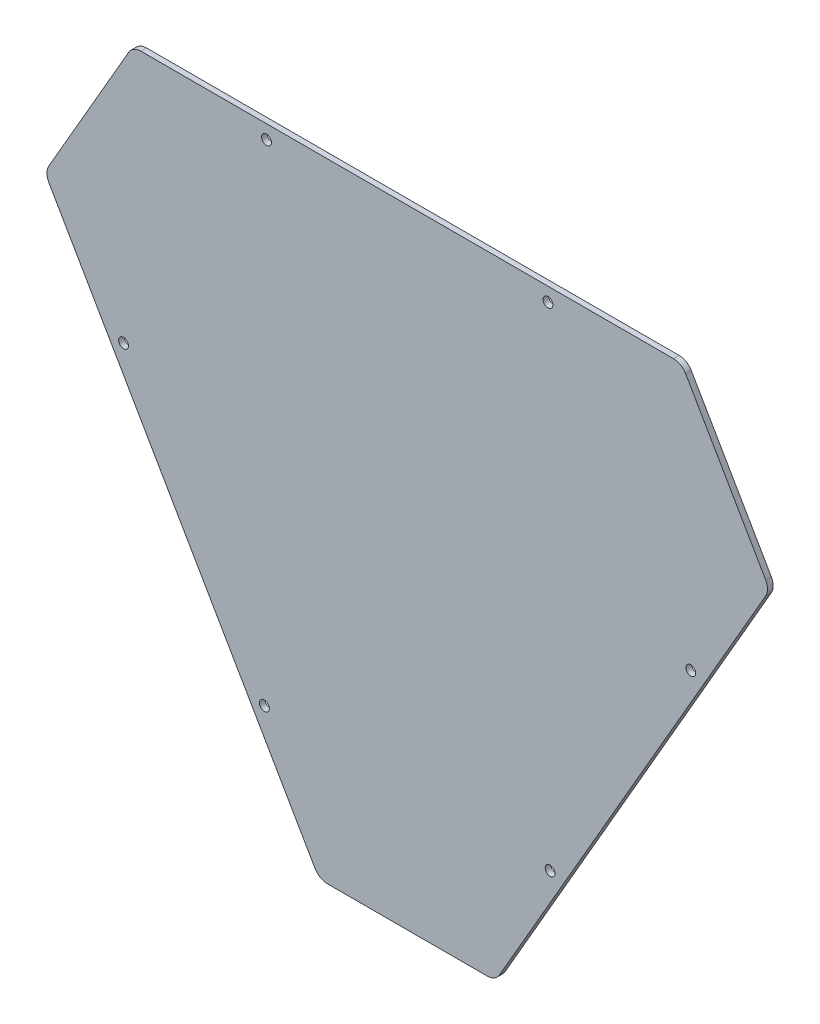
from build123d import *

# Parameters (mm, degrees)
ESTRUSIONE_ESTRUSIONE1_DEPTH = 4
RACCORDO1_R                  = 10
SCHIZZO2_R                   = 3.5
TAGLIO_ESTRUSIONE1_DEPTH     = 10


with BuildPart() as part:
    # Schizzo1 → Estrusione-Estrusione1 (new body)
    with BuildSketch(Plane(origin=(0, 0, 0), x_dir=(-1, 0, 0), z_dir=(0, 0, 1))):
        Polygon((559.259871964, -2.574697247), (461.759871964, 166.300256491), (364.223704599, 335.112566514), (239.016445177, 335.112566514), (44.088779908, -2.637340962), (106.656242253, -111.007364644), (496.656242253, -111.007364644), align=None)
    extrude(amount=ESTRUSIONE_ESTRUSIONE1_DEPTH)

    # Raccordo1
    raccordo1_edges = [part.edges().sort_by_distance(p)[0] for p in [
        (-559.259871964, 2.574697247, 2),
        (-496.656242253, 111.007364644, 2),
        (-106.656242253, 111.007364644, 2),
        (-44.088779908, 2.637340962, 2),
        (-239.016445177, -335.112566514, 2),
        (-364.223704599, -335.112566514, 2),
    ]]
    fillet(raccordo1_edges, radius=RACCORDO1_R)

    # Schizzo2 → Taglio-Estrusione1 (cut)
    with BuildSketch(Plane.XY.offset(4)):
        with Locations((-503.182756728, -74.746951028)):
            Circle(SCHIZZO2_R)
        with Locations((-403.12710947, -247.919891905)):
            Circle(SCHIZZO2_R)
        with Locations((-201.661073821, 101.160104014)):
            Circle(SCHIZZO2_R)
        with Locations((-401.661063497, 101.095842135)):
            Circle(SCHIZZO2_R)
        with Locations((-200.081936903, -247.918860697)):
            Circle(SCHIZZO2_R)
        with Locations((-100.137594485, -74.681657941)):
            Circle(SCHIZZO2_R)
    extrude(amount=-TAGLIO_ESTRUSIONE1_DEPTH, mode=Mode.SUBTRACT)


solid = part.part
